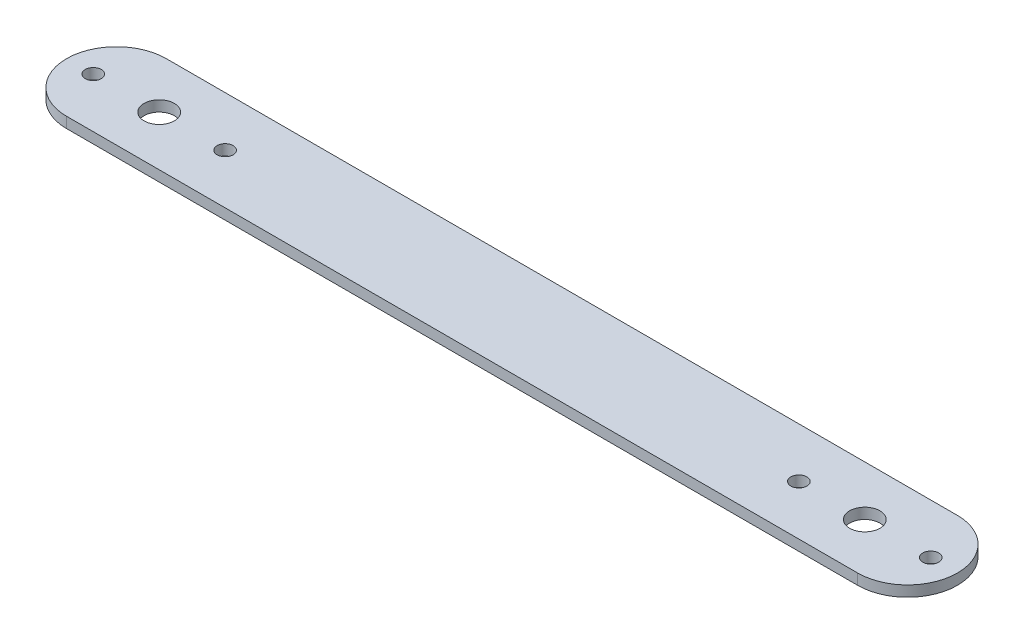
from build123d import *

# Parameters (mm, degrees)
SKETCH_1_W          = 250
SKETCH_1_H          = 28
EXTRUDE_1_DEPTH     = 3
CUT_EXTRUDE_1_REACH = 127.817
SKETCH_2_R          = 4.25
CUT_EXTRUDE_2_REACH = 127.817
SKETCH_3_R          = 2.25
FILLET_1_RADIUS     = 14
FILLET_1_LENGTH     = 3
FILLET_2_RADIUS     = 14
FILLET_2_LENGTH     = 3


with BuildPart() as part:
    # 草图1 → 凸台-拉伸1 (new body)
    with BuildSketch(Plane(origin=(0, 0, 0), x_dir=(1, 0, 0), z_dir=(0, 1, 0))):
        Rectangle(SKETCH_1_W, SKETCH_1_H)
    extrude(amount=EXTRUDE_1_DEPTH)

    # 草图2 → 切除-拉伸1 (cut, up to next)
    with BuildSketch(Plane(origin=(0, 3, 0), x_dir=(1, 0, 0), z_dir=(0, 1, 0)), mode=Mode.PRIVATE) as cut_extrude_1_sk1:
        with Locations(Location((-99, 0, 0), (0, 0, 270))):
            Circle(SKETCH_2_R)
    cut_extrude_1_tool1 = extrude(cut_extrude_1_sk1.sketch, amount=-CUT_EXTRUDE_1_REACH, mode=Mode.PRIVATE) & part.part
    # 草图2 → 切除-拉伸1 (cut, up to next)
    with BuildSketch(Plane(origin=(0, 3, 0), x_dir=(1, 0, 0), z_dir=(0, 1, 0)), mode=Mode.PRIVATE) as cut_extrude_1_sk2:
        with Locations(Location((99, 0, 0), (0, 0, 270))):
            Circle(SKETCH_2_R)
    cut_extrude_1_tool2 = extrude(cut_extrude_1_sk2.sketch, amount=-CUT_EXTRUDE_1_REACH, mode=Mode.PRIVATE) & part.part
    add(cut_extrude_1_tool1.solids().sort_by_distance((-99, 3, 0))[0], mode=Mode.SUBTRACT)
    add(cut_extrude_1_tool2.solids().sort_by_distance((99, 3, 0))[0], mode=Mode.SUBTRACT)

    # 草图3 → 切除-拉伸2 (cut, up to next)
    with BuildSketch(Plane(origin=(0, 3, 0), x_dir=(1, 0, 0), z_dir=(0, 1, 0)), mode=Mode.PRIVATE) as cut_extrude_2_sk1:
        with Locations(Location((-117.5, 0, 0), (0, 0, 270))):
            Circle(SKETCH_3_R)
    cut_extrude_2_tool1 = extrude(cut_extrude_2_sk1.sketch, amount=-CUT_EXTRUDE_2_REACH, mode=Mode.PRIVATE) & part.part
    # 草图3 → 切除-拉伸2 (cut, up to next)
    with BuildSketch(Plane(origin=(0, 3, 0), x_dir=(1, 0, 0), z_dir=(0, 1, 0)), mode=Mode.PRIVATE) as cut_extrude_2_sk2:
        with Locations(Location((-80.5, 0, 0), (0, 0, 270))):
            Circle(SKETCH_3_R)
    cut_extrude_2_tool2 = extrude(cut_extrude_2_sk2.sketch, amount=-CUT_EXTRUDE_2_REACH, mode=Mode.PRIVATE) & part.part
    # 草图3 → 切除-拉伸2 (cut, up to next)
    with BuildSketch(Plane(origin=(0, 3, 0), x_dir=(1, 0, 0), z_dir=(0, 1, 0)), mode=Mode.PRIVATE) as cut_extrude_2_sk3:
        with Locations(Location((80.5, 0, 0), (0, 0, 270))):
            Circle(SKETCH_3_R)
    cut_extrude_2_tool3 = extrude(cut_extrude_2_sk3.sketch, amount=-CUT_EXTRUDE_2_REACH, mode=Mode.PRIVATE) & part.part
    # 草图3 → 切除-拉伸2 (cut, up to next)
    with BuildSketch(Plane(origin=(0, 3, 0), x_dir=(1, 0, 0), z_dir=(0, 1, 0)), mode=Mode.PRIVATE) as cut_extrude_2_sk4:
        with Locations(Location((117.5, 0, 0), (0, 0, 270))):
            Circle(SKETCH_3_R)
    cut_extrude_2_tool4 = extrude(cut_extrude_2_sk4.sketch, amount=-CUT_EXTRUDE_2_REACH, mode=Mode.PRIVATE) & part.part
    add(cut_extrude_2_tool1.solids().sort_by_distance((-117.5, 3, 0))[0], mode=Mode.SUBTRACT)
    add(cut_extrude_2_tool2.solids().sort_by_distance((-80.5, 3, 0))[0], mode=Mode.SUBTRACT)
    add(cut_extrude_2_tool3.solids().sort_by_distance((80.5, 3, 0))[0], mode=Mode.SUBTRACT)
    add(cut_extrude_2_tool4.solids().sort_by_distance((117.5, 3, 0))[0], mode=Mode.SUBTRACT)

    # 圆角1: full round fillet: the end face becomes a half cylinder, R = half its width
    fillet_1_face = Plane((-125, 1.5, 0), x_dir=(0, 1, 0), z_dir=(-1, 0, 0))  # on the end face: x along it, z out of the body
    fillet_1_slab = fillet_1_face.offset(-FILLET_1_RADIUS / 2) * Box(FILLET_1_LENGTH, 2 * FILLET_1_RADIUS, FILLET_1_RADIUS, mode=Mode.PRIVATE)  # the body's end, R deep
    fillet_1_round = Plane((-111, 1.5, 0), x_dir=(-1, 0, 0), z_dir=(0, 1, 0)) * Cylinder(FILLET_1_RADIUS, FILLET_1_LENGTH, mode=Mode.PRIVATE)  # its axis R under the face
    add(fillet_1_slab - fillet_1_round, mode=Mode.SUBTRACT)

    # 圆角2: full round fillet: the end face becomes a half cylinder, R = half its width
    fillet_2_face = Plane((125, 1.5, 0), x_dir=(0, -1, 0), z_dir=(1, 0, 0))  # on the end face: x along it, z out of the body
    fillet_2_slab = fillet_2_face.offset(-FILLET_2_RADIUS / 2) * Box(FILLET_2_LENGTH, 2 * FILLET_2_RADIUS, FILLET_2_RADIUS, mode=Mode.PRIVATE)  # the body's end, R deep
    fillet_2_round = Plane((111, 1.5, 0), x_dir=(1, 0, 0), z_dir=(0, -1, 0)) * Cylinder(FILLET_2_RADIUS, FILLET_2_LENGTH, mode=Mode.PRIVATE)  # its axis R under the face
    add(fillet_2_slab - fillet_2_round, mode=Mode.SUBTRACT)


solid = part.part
